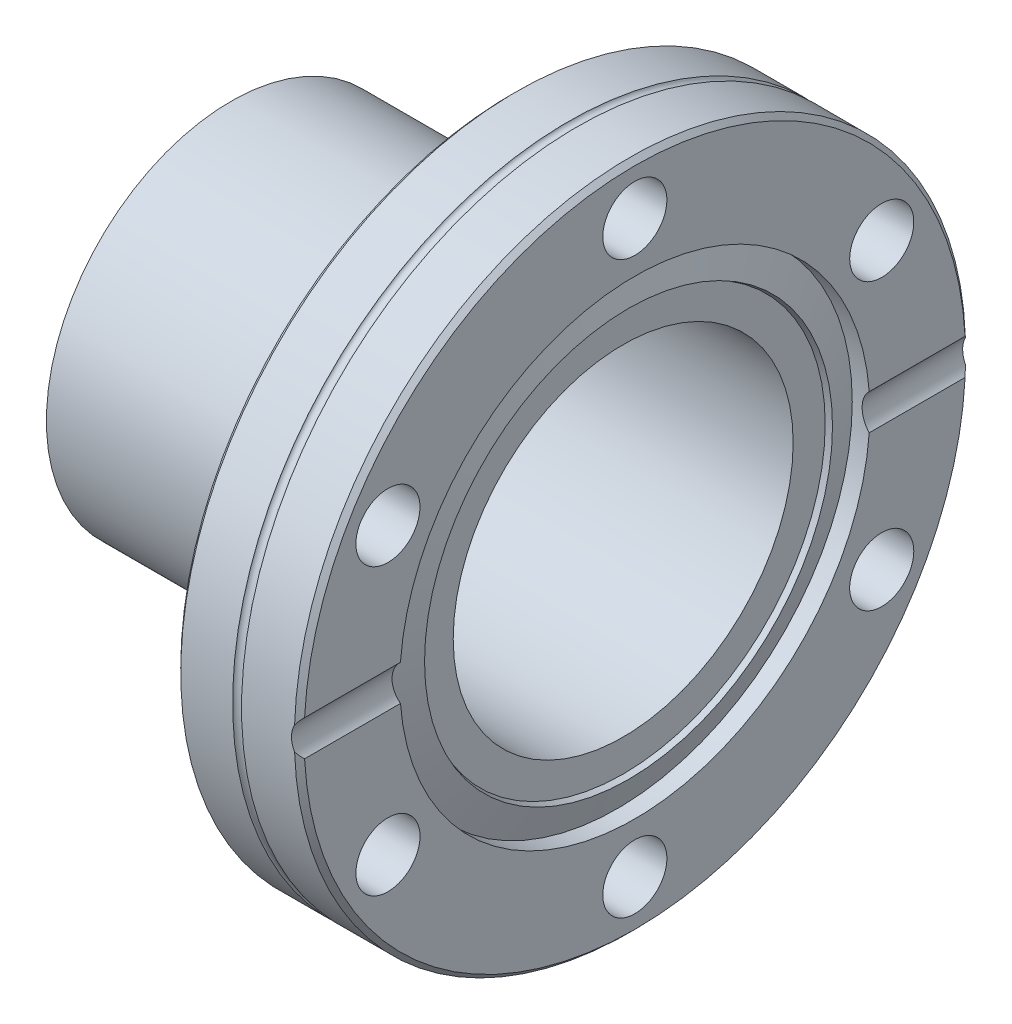
from build123d import *

# Parameters (mm, degrees)
HOLE_WIZARD_M61_D        = 6.6
PATTERN_CIRCULAR_3_COUNT = 6
SKETCH_6_R               = 2.5
CUT_EXTRUDE_1_DEPTH      = 12
PATTERN_CIRCULAR_2_COUNT = 2
SKETCH_7_W               = 21.42
SKETCH_7_H               = 1.5


with BuildPart() as part:
    # Эскиз1 → Повернуть2 (revolve)
    with BuildSketch(Plane.XY):
        with BuildLine():
            Line((-7.258257569, 34.55), (-12.6, 34.55))
            Line((-12.6, 34.55), (-13.1, 34.05))
            Line((-13.1, 34.05), (-13.1, 19))
            Line((-13.1, 19), (-63.4, 19))
            Line((-63.4, 19), (-63.4, 17.5))
            Line((-63.4, 17.5), (-1.6, 17.5))
            Line((-1.6, 17.5), (-1.6, 20.799816371))
            Line((-1.6, 20.799816371), (-1.05, 21))
            Line((-1.05, 21), (-2.21470475, 24.2))
            Line((-2.21470475, 24.2), (-0.4, 24.2))
            Line((-0.4, 24.2), (-0.4, 34.05))
            Line((-0.4, 34.05), (-0.9, 34.55))
            Line((-0.9, 34.55), (-6.341742431, 34.55))
            ThreePointArc((-6.341742431, 34.55), (-6.8, 34.25), (-7.258257569, 34.55))
        make_face()
    revolve(axis=Axis((0, 0, 0), (-1, 0, 0)))

    # Отверстие с зазором M61 (through all)
    with Locations(Plane(origin=(-0.4, 0, 0), x_dir=(0, 0, -1), z_dir=(1, 0, 0))):
        with Locations((0, 29.35)):
            hole_wizard_m61 = Hole(HOLE_WIZARD_M61_D / 2)

    # Круговой массив3: Отверстие с зазором M61 ×6 about axis
    pattern_circular_3_axis = Axis((-110.150658921, 0, 0), (1, 0, 0))
    for i in range(1, PATTERN_CIRCULAR_3_COUNT):
        add(hole_wizard_m61.rotate(pattern_circular_3_axis, i * 360 / PATTERN_CIRCULAR_3_COUNT), mode=Mode.SUBTRACT)

    # Эскиз6 → Вырез-Вытянуть1 (cut)
    with BuildSketch(Plane(origin=(0, 0, -34.55), x_dir=(-1, 0, 0), z_dir=(0, 0, -1))):
        with Locations((-1.3, 0)):
            Circle(SKETCH_6_R)
    cut_extrude_1 = extrude(amount=-CUT_EXTRUDE_1_DEPTH, mode=Mode.SUBTRACT)

    # Круговой массив2: Вырез-Вытянуть1 ×2 about axis
    pattern_circular_2_axis = Axis((-110.150658921, 0, 0), (1, 0, 0))
    for i in range(1, PATTERN_CIRCULAR_2_COUNT):
        add(cut_extrude_1.rotate(pattern_circular_2_axis, i * 360 / PATTERN_CIRCULAR_2_COUNT), mode=Mode.SUBTRACT)

    # Эскиз7 → Вырез-Повернуть1 (revolve, cut)
    with BuildSketch(Plane.XY):
        with Locations((-52.69, 18.25)):
            Rectangle(SKETCH_7_W, SKETCH_7_H)
    revolve(axis=Axis((0, 0, 0), (-1, 0, 0)), mode=Mode.SUBTRACT)


solid = part.part
